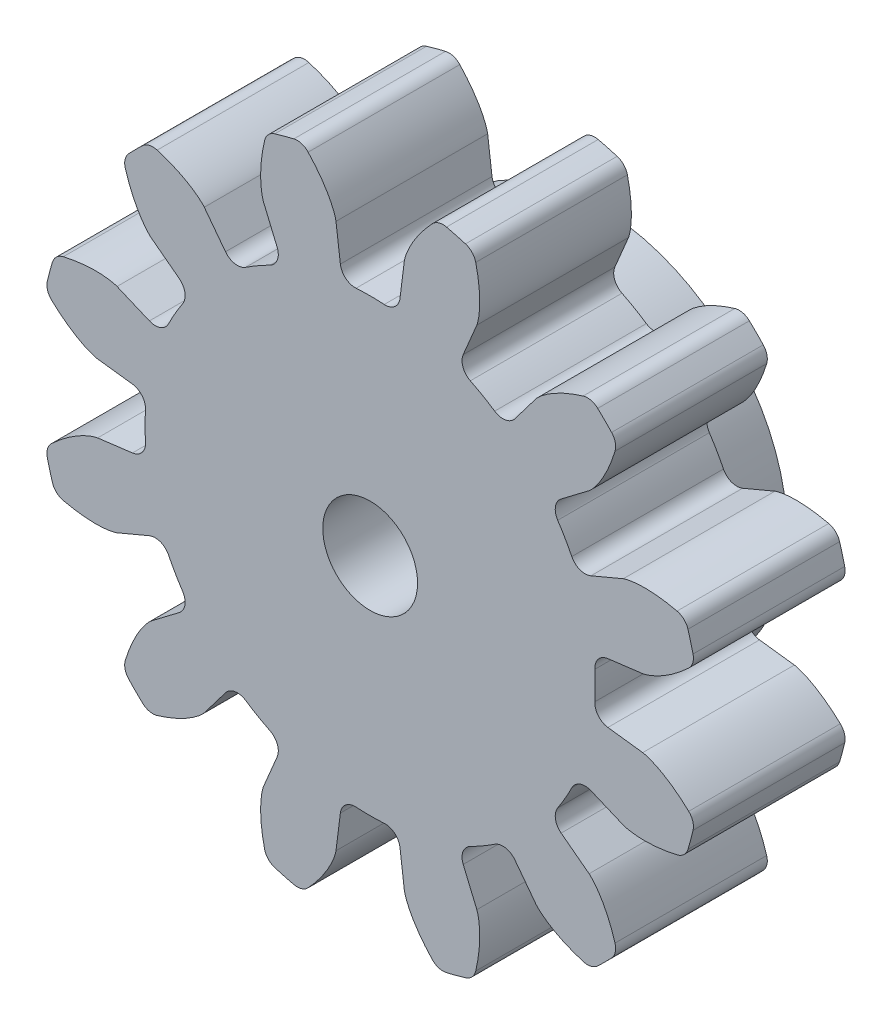
from build123d import *

# Parameters (mm, degrees)
SKETCH1_R                = 8.75
BOSS_EXTRUDE1_DEPTH      = 4
CUT_EXTRUDE1_DEPTH       = 14.004806804
FILLET1_R                = 0.393380952
CIRPATTERN1_COUNT        = 12
FILLET1_OF_CIRPATTERN1_R = 0.393380952
SKETCH4_R                = 5
BOSS_EXTRUDE2_DEPTH      = 2
CUT_EXTRUDE2_DEPTH       = 2
CUT_EXTRUDE2_DEPTH_BACK  = 2
SKETCH3_R                = 2.9
SKETCH5_R                = 1.25
CUT_EXTRUDE3_DEPTH       = 13.703353196


with BuildPart() as part:
    # Sketch1 → Boss-Extrude1 (new body)
    with BuildSketch(Plane.XY):
        Circle(SKETCH1_R)
    extrude(amount=BOSS_EXTRUDE1_DEPTH)

    # Sketch2 → Cut-Extrude1 (cut, through all)
    with BuildSketch(Plane.XY.offset(4)):
        with BuildLine():
            Line((7.188145812, 0.901401282), (5.891358611, 0.738782761))
            ThreePointArc((5.891358611, 0.738782761), (5.9375, 0), (5.891358611, -0.738782761))
            Line((5.891358611, -0.738782761), (7.188145812, -0.901401282))
            add(Edge.make_bspline(
                [(7.188145812, -0.901401282), (7.190579777, -0.901741998), (7.197391181, -0.902805625), (7.210205817, -0.905242636), (7.23101261, -0.909822185), (7.257360553, -0.916541261), (7.291207198, -0.926236485), (7.330791133, -0.938952588), (7.373965969, -0.954277408), (7.420559753, -0.97239948), (7.466688999, -0.991754376), (7.512356189, -1.012242451), (7.557520927, -1.033712622), (7.611823547, -1.060965521), (7.676359788, -1.095371492), (7.750898718, -1.138080016), (7.834342106, -1.189443527), (7.918143121, -1.244883144), (7.999559346, -1.301965156), (8.080551907, -1.362507526), (8.158013357, -1.423116155), (8.237093534, -1.488957752), (8.309392832, -1.551206431), (8.388794945, -1.624092265), (8.452412257, -1.683834922), (8.516747156, -1.748135323), (8.54785322, -1.779810517), (8.563662607, -1.796157773)],
                knots=[0, 0, 0, 0, 0, 0.005376749, 0.015083688, 0.02853182, 0.04661014, 0.064854849, 0.092110525, 0.119476176, 0.146842496, 0.174208854, 0.201574956, 0.228941013, 0.256307345, 0.307035032, 0.361767352, 0.416499661, 0.471231937, 0.525964282, 0.580696616, 0.635428982, 0.690161387, 0.744893688, 0.799626082, 0.854358408, 0.909090915, 0.909090915, 0.909090915, 0.909090915, 0.909090915], degree=4))
            ThreePointArc((8.563662607, -1.796157773), (8.703290981, -0.902898717), (8.75, 0))
            ThreePointArc((8.75, 0), (8.703290981, 0.902898717), (8.563662607, 1.796157773))
            add(Edge.make_bspline(
                [(7.188145812, 0.901401282), (7.190579777, 0.901741998), (7.197391181, 0.902805625), (7.210205817, 0.905242636), (7.23101261, 0.909822185), (7.257360553, 0.916541261), (7.291207198, 0.926236485), (7.330791133, 0.938952588), (7.373965969, 0.954277408), (7.420559753, 0.97239948), (7.466688999, 0.991754376), (7.512356189, 1.012242451), (7.557520927, 1.033712622), (7.611823547, 1.060965521), (7.676359788, 1.095371492), (7.750898718, 1.138080016), (7.834342106, 1.189443527), (7.918143121, 1.244883144), (7.999559346, 1.301965156), (8.080551907, 1.362507526), (8.158013357, 1.423116155), (8.237093534, 1.488957752), (8.309392832, 1.551206431), (8.388794945, 1.624092265), (8.452412257, 1.683834922), (8.516747156, 1.748135323), (8.54785322, 1.779810517), (8.563662607, 1.796157773)],
                knots=[0, 0, 0, 0, 0, 0.005376749, 0.015083688, 0.02853182, 0.04661014, 0.064854849, 0.092110525, 0.119476176, 0.146842496, 0.174208854, 0.201574956, 0.228941013, 0.256307345, 0.307035032, 0.361767352, 0.416499661, 0.471231937, 0.525964282, 0.580696616, 0.635428982, 0.690161387, 0.744893688, 0.799626082, 0.854358408, 0.909090915, 0.909090915, 0.909090915, 0.909090915, 0.909090915], degree=4))
        make_face()
    cut_extrude1 = extrude(amount=-CUT_EXTRUDE1_DEPTH, mode=Mode.SUBTRACT)

    # Fillet1
    fillet1_edges = [part.edges().sort_by_distance(p)[0] for p in [
        (5.891358611, -0.738782761, 2),
        (5.891358611, 0.738782761, 2),
        (8.563662607, -1.796157773, 2),
        (8.563662607, 1.796157773, 2),
    ]]
    fillet(fillet1_edges, radius=FILLET1_R)

    # CirPattern1: Cut-Extrude1 ×12 about axis
    cirpattern1_axis = Axis((0, 0, 0), (0, 0, 1))
    for i in range(1, CIRPATTERN1_COUNT):
        add(cut_extrude1.rotate(cirpattern1_axis, i * 360 / CIRPATTERN1_COUNT), mode=Mode.SUBTRACT)

    # Fillet1 of CirPattern1
    fillet1_of_cirpattern1_edges = [part.edges().sort_by_distance(p)[0] for p in [
        (5.4714576, 2.305874667, 2),
        (4.73267484, 3.585483944, 2),
        (8.314428254, 2.726313043, 2),
        (6.518270481, 5.837349564, 2),
        (3.585483944, 4.73267484, 2),
        (2.305874667, 5.4714576, 2),
        (5.837349564, 6.518270481, 2),
        (2.726313043, 8.314428254, 2),
        (0.738782761, 5.891358611, 2),
        (-0.738782761, 5.891358611, 2),
        (1.796157773, 8.563662607, 2),
        (-1.796157773, 8.563662607, 2),
        (-2.305874667, 5.4714576, 2),
        (-3.585483944, 4.73267484, 2),
        (-2.726313043, 8.314428254, 2),
        (-5.837349564, 6.518270481, 2),
        (-4.73267484, 3.585483944, 2),
        (-5.4714576, 2.305874667, 2),
        (-6.518270481, 5.837349564, 2),
        (-8.314428254, 2.726313043, 2),
        (-5.891358611, 0.738782761, 2),
        (-5.891358611, -0.738782761, 2),
        (-8.563662607, 1.796157773, 2),
        (-8.563662607, -1.796157773, 2),
        (-5.4714576, -2.305874667, 2),
        (-4.73267484, -3.585483944, 2),
        (-8.314428254, -2.726313043, 2),
        (-6.518270481, -5.837349564, 2),
        (-3.585483944, -4.73267484, 2),
        (-2.305874667, -5.4714576, 2),
        (-5.837349564, -6.518270481, 2),
        (-2.726313043, -8.314428254, 2),
        (-0.738782761, -5.891358611, 2),
        (0.738782761, -5.891358611, 2),
        (-1.796157773, -8.563662607, 2),
        (1.796157773, -8.563662607, 2),
        (2.305874667, -5.4714576, 2),
        (3.585483944, -4.73267484, 2),
        (2.726313043, -8.314428254, 2),
        (5.837349564, -6.518270481, 2),
        (4.73267484, -3.585483944, 2),
        (5.4714576, -2.305874667, 2),
        (6.518270481, -5.837349564, 2),
        (8.314428254, -2.726313043, 2),
    ]]
    fillet(fillet1_of_cirpattern1_edges, radius=FILLET1_OF_CIRPATTERN1_R)

    # Sketch4 → Boss-Extrude2 (add)
    with BuildSketch(Plane.XY):
        Circle(SKETCH4_R)
    extrude(amount=-BOSS_EXTRUDE2_DEPTH)

    # Sketch3 → Cut-Extrude2 (cut, two sides: drawn at the far end of the back side and taken through both)
    with BuildSketch(Plane.XY.offset(-CUT_EXTRUDE2_DEPTH_BACK)):
        Circle(SKETCH3_R)
    extrude(amount=CUT_EXTRUDE2_DEPTH + CUT_EXTRUDE2_DEPTH_BACK, mode=Mode.SUBTRACT)

    # Sketch5 → Cut-Extrude3 (cut, through all)
    with BuildSketch(Plane.XY):
        Circle(SKETCH5_R)
    extrude(amount=CUT_EXTRUDE3_DEPTH, mode=Mode.SUBTRACT)


solid = part.part
